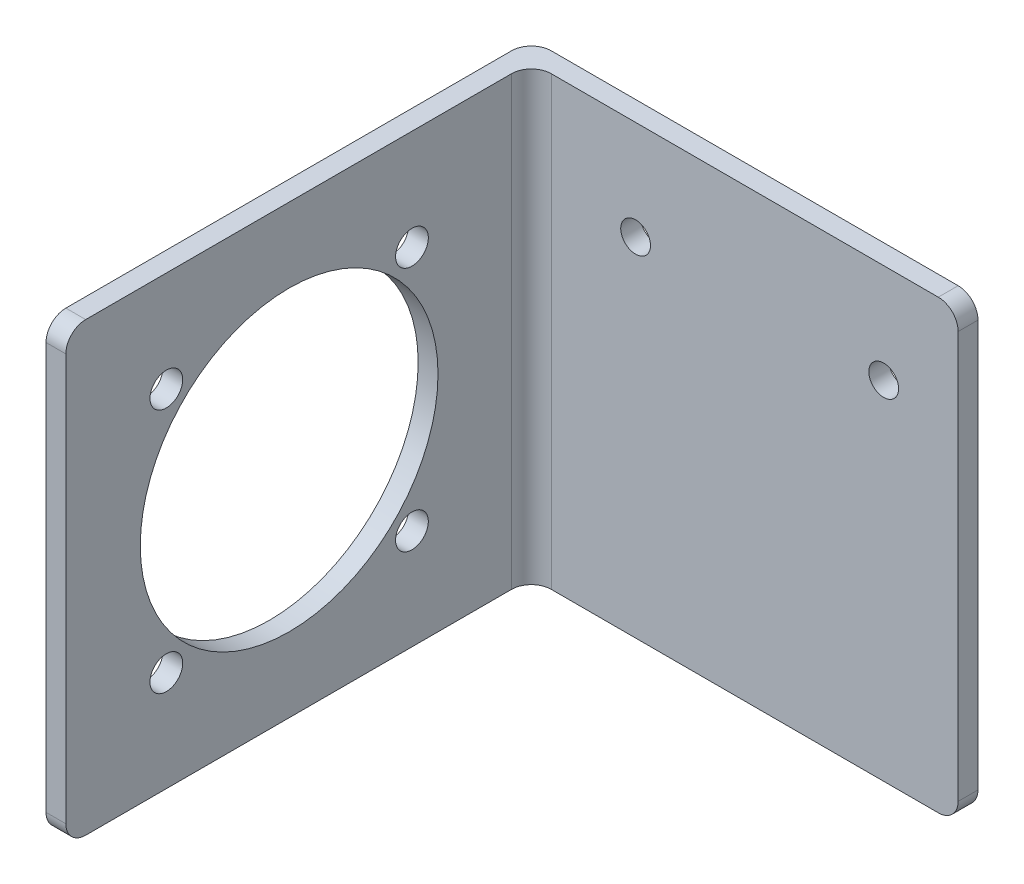
from build123d import *

# Parameters (mm, degrees)
EXTRUDE_1_DEPTH     = 45
FILLET_1_R          = 2
SKETCH_2_R          = 15
CUT_EXTRUDE_1_DEPTH = 10
FILLET_2_R          = 2
SKETCH_4_R          = 1.65
CUT_EXTRUDE_2_DEPTH = 10
SKETCH_5_R          = 1.5
CUT_EXTRUDE_3_DEPTH = 10


with BuildPart() as part:
    # 草图1 → 拉伸-薄壁1 (new body)
    with BuildSketch(Plane(origin=(0, 0, 0), x_dir=(1, 0, 0), z_dir=(0, 1, 0))):
        Polygon((0, 0), (0, 48.91), (45, 48.91), (45, 46.91), (2, 46.91), (2, 0), align=None)
    extrude(amount=EXTRUDE_1_DEPTH)

    # 圆角1
    fillet_1_edges = [part.edges().sort_by_distance(p)[0] for p in [
        (2, 22.5, -46.91),
        (0, 22.5, -48.91),
    ]]
    fillet(fillet_1_edges, radius=FILLET_1_R)

    # 草图2 → 切除-拉伸1 (cut)
    with BuildSketch(Plane.ZY):
        with Locations((-22.5, 22.5)):
            Circle(SKETCH_2_R)
    extrude(amount=-CUT_EXTRUDE_1_DEPTH, mode=Mode.SUBTRACT)

    # 圆角2
    fillet_2_edges = [part.edges().sort_by_distance(p)[0] for p in [
        (1, 45, 0),
        (1, 0, 0),
        (45, 0, -47.91),
        (45, 45, -47.91),
    ]]
    fillet(fillet_2_edges, radius=FILLET_2_R)

    # 草图4 → 切除-拉伸2 (cut)
    with BuildSketch(Plane.ZY):
        with Locations((-34.874368671, 10.125631329)):
            Circle(SKETCH_4_R)
        with Locations((-10.125631329, 10.125631329)):
            Circle(SKETCH_4_R)
        with Locations((-10.125631329, 34.874368671)):
            Circle(SKETCH_4_R)
        with Locations((-34.874368671, 34.874368671)):
            Circle(SKETCH_4_R)
    extrude(amount=-CUT_EXTRUDE_2_DEPTH, mode=Mode.SUBTRACT)

    # 草图5 → 切除-拉伸3 (cut)
    with BuildSketch(Plane.XY.offset(-46.91)):
        with Locations((12.5, 35)):
            Circle(SKETCH_5_R)
        with Locations((37.5, 35)):
            Circle(SKETCH_5_R)
    extrude(amount=-CUT_EXTRUDE_3_DEPTH, mode=Mode.SUBTRACT)


solid = part.part
